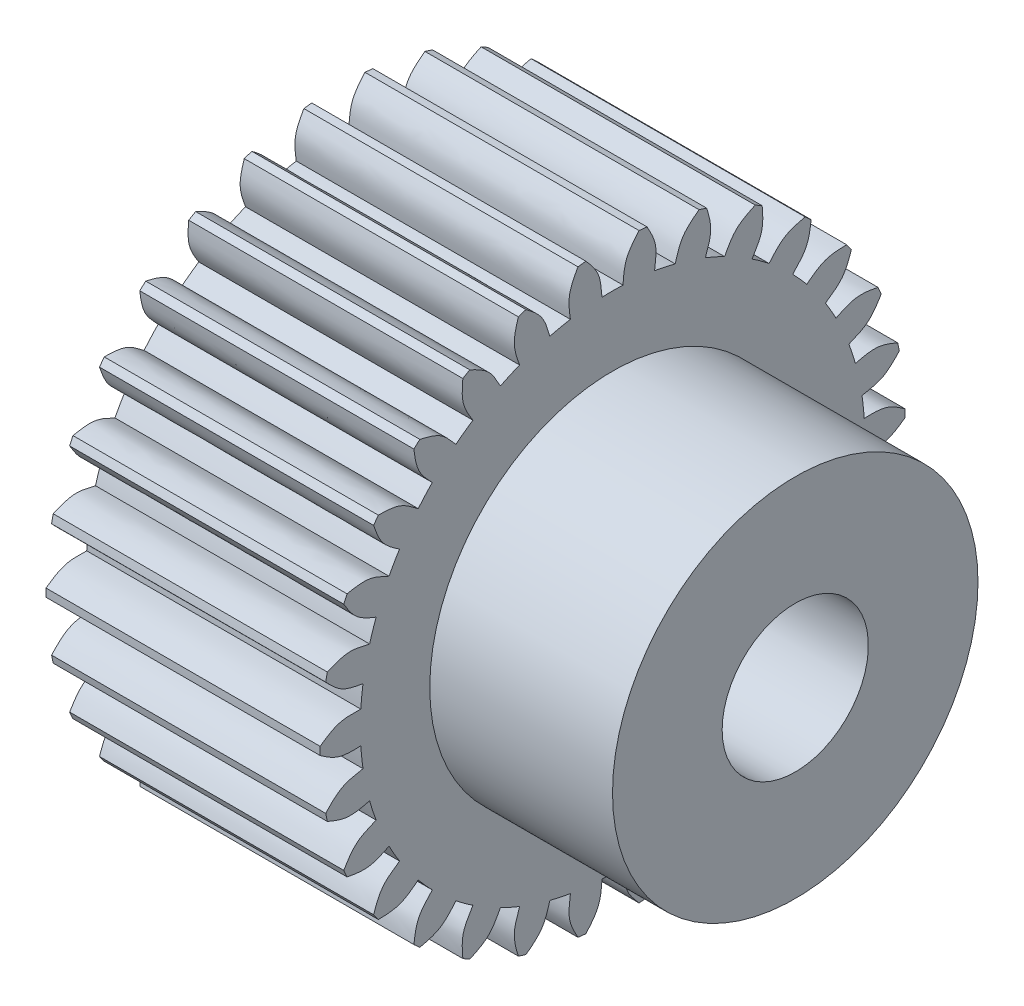
from build123d import *

# Parameters (mm, degrees)
KUGGLUCKA_DEPTH  = 15
CIRPATTERN_COUNT = 30


with BuildPart() as part:
    # Ritning 1 → Kugghjulsämne (revolve)
    with BuildSketch(Plane.XY, mode=Mode.PRIVATE) as kugghjuls_mne_sk:
        Polygon((-12.5, -4), (12.5, -4), (12.5, 2), (2.5, 2), (2.5, 8), (-12.5, 8), align=None)
    revolve(kugghjuls_mne_sk.sketch.rotate(Axis((-12.5, -8, 0), (1, 0, 0)), 90), axis=Axis((-12.5, -8, 0), (1, 0, 0)))

    # Ritning 2 → Kugglucka (cut)
    with BuildSketch(Plane.ZY.offset(12.5)):
        with BuildLine():
            Line((1.453677712, 7.933826317), (0, 9.387504029))
            Line((0, 9.387504029), (-1.453677712, 7.933826317))
            add(Edge.make_bspline(
                [(-1.453677712, 7.933826317), (-1.192818546, 7.631473536), (-0.661094101, 7.015170236), (-0.604266726, 6.202158128), (-0.575318344, 5.78800235)],
                knots=[0, 0, 0, 0, 0.490590885, 1, 1, 1, 1], degree=3))
            ThreePointArc((-0.575318344, 5.78800235), (0, 5.8), (0.575318344, 5.78800235))
            add(Edge.make_bspline(
                [(1.453677712, 7.933826317), (1.192818546, 7.631473536), (0.661094101, 7.015170236), (0.604266726, 6.202158128), (0.575318344, 5.78800235)],
                knots=[0, 0, 0, 0, 0.490590885, 1, 1, 1, 1], degree=3))
        make_face()
    kugglucka = extrude(amount=-KUGGLUCKA_DEPTH, mode=Mode.SUBTRACT)

    # CirPattern: Kugglucka ×30 about axis
    cirpattern_axis = Axis((-12.5, -8, 0), (-1, 0, 0))
    for i in range(1, CIRPATTERN_COUNT):
        add(kugglucka.rotate(cirpattern_axis, i * 360 / CIRPATTERN_COUNT), mode=Mode.SUBTRACT)


solid = part.part
